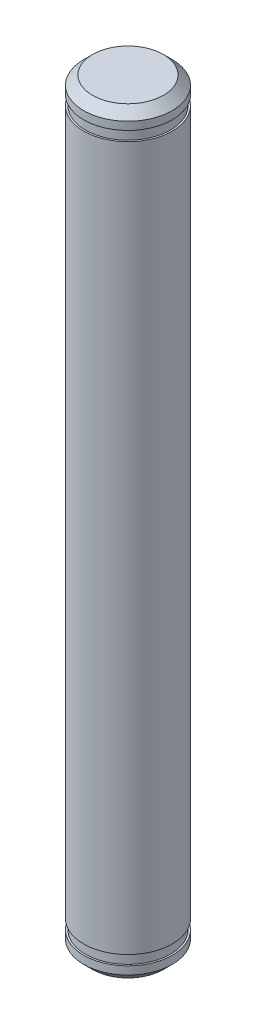
from build123d import *

# Parameters (mm, degrees)
CHAMFER_1_SIZE      = 1
CUT_EXTRUDE_START   = -3
SKETCH_2_R          = 5
SKETCH_2_R_2        = 4.8
CUT_EXTRUDE_1_DEPTH = 1.1


with BuildPart() as part:
    # 草图1 → 旋转1 (revolve)
    with BuildSketch(Plane.XY, mode=Mode.PRIVATE) as revolve_1_sk:
        Polygon((0, 42.75), (5, 42.75), (5, 29.00117383), (5, -29.00117383), (5, -42.75), (0, -42.75), align=None)
    revolve(revolve_1_sk.sketch.rotate(Axis((0, 42.75, 0), (0, -1, 0)), 90), axis=Axis((0, 42.75, 0), (0, -1, 0)))

    # 倒角1
    chamfer_1_edges = [part.edges().sort_by_distance(p)[0] for p in [
        (0, -42.75, -5),
        (0, 42.75, -5),
    ]]
    chamfer(chamfer_1_edges, length=CHAMFER_1_SIZE)

    # 草图2 → 切除-拉伸1 (cut)
    with BuildSketch(Plane(origin=(0, 42.75, 0), x_dir=(1, 0, 0), z_dir=(0, 1, 0)).offset(CUT_EXTRUDE_START)):
        with Locations(Location((0, 0, 0), (0, 0, 180))):
            Circle(SKETCH_2_R)
        with Locations(Location((0, 0, 0), (0, 0, 180))):
            Circle(SKETCH_2_R_2, mode=Mode.SUBTRACT)
    cut_extrude_1 = extrude(amount=CUT_EXTRUDE_1_DEPTH, mode=Mode.SUBTRACT)

    # 镜向1: 切除-拉伸1 across plane
    add(cut_extrude_1.mirror(Plane.ZX), mode=Mode.SUBTRACT)


solid = part.part
